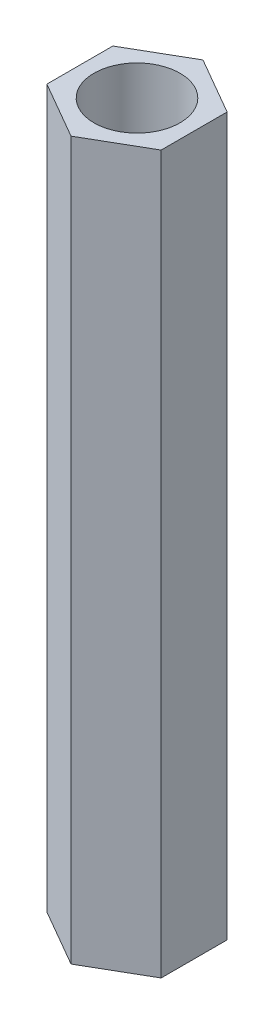
from build123d import *

# Parameters (mm, degrees)
SKETCH_1_R      = 1.5
EXTRUDE_1_DEPTH = 25


with BuildPart() as part:
    # 草图1 → 凸台-拉伸1 (new body)
    with BuildSketch(Plane(origin=(0, 0, 0), x_dir=(1, 0, 0), z_dir=(0, 1, 0))):
        Polygon((0, 2.3), (-1.991858429, 1.15), (-1.991858429, -1.15), (0, -2.3), (1.991858429, -1.15), (1.991858429, 1.15), align=None)
        with Locations(Location((0, 0, 0), (0, 0, 270))):
            Circle(SKETCH_1_R, mode=Mode.SUBTRACT)
    extrude(amount=EXTRUDE_1_DEPTH)


solid = part.part
